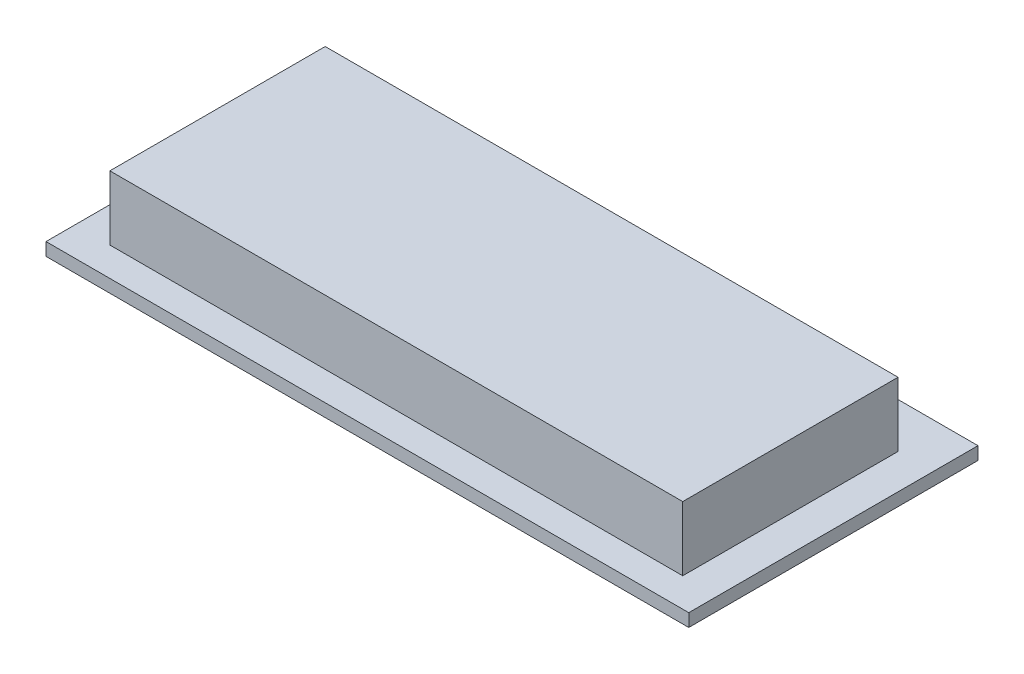
from build123d import *

# Parameters (mm, degrees)
SKETCH1_W           = 80
SKETCH1_H           = 36
BOSS_EXTRUDE1_DEPTH = 1.6
SKETCH2_W           = 71.3
SKETCH2_H           = 26.8
BOSS_EXTRUDE2_DEPTH = 8


with BuildPart() as part:
    # Sketch1 → Boss-Extrude1 (new body)
    with BuildSketch(Plane(origin=(0, 0, 0), x_dir=(1, 0, 0), z_dir=(0, 1, 0))):
        with Locations((-39, 24.138513514)):
            Rectangle(SKETCH1_W, SKETCH1_H)
    extrude(amount=BOSS_EXTRUDE1_DEPTH)

    # Sketch2 → Boss-Extrude2 (add)
    with BuildSketch(Plane(origin=(0, 1.6, 0), x_dir=(1, 0, 0), z_dir=(0, 1, 0))):
        with Locations((-39, 23.138513514)):
            Rectangle(SKETCH2_W, SKETCH2_H)
    extrude(amount=BOSS_EXTRUDE2_DEPTH)


solid = part.part
